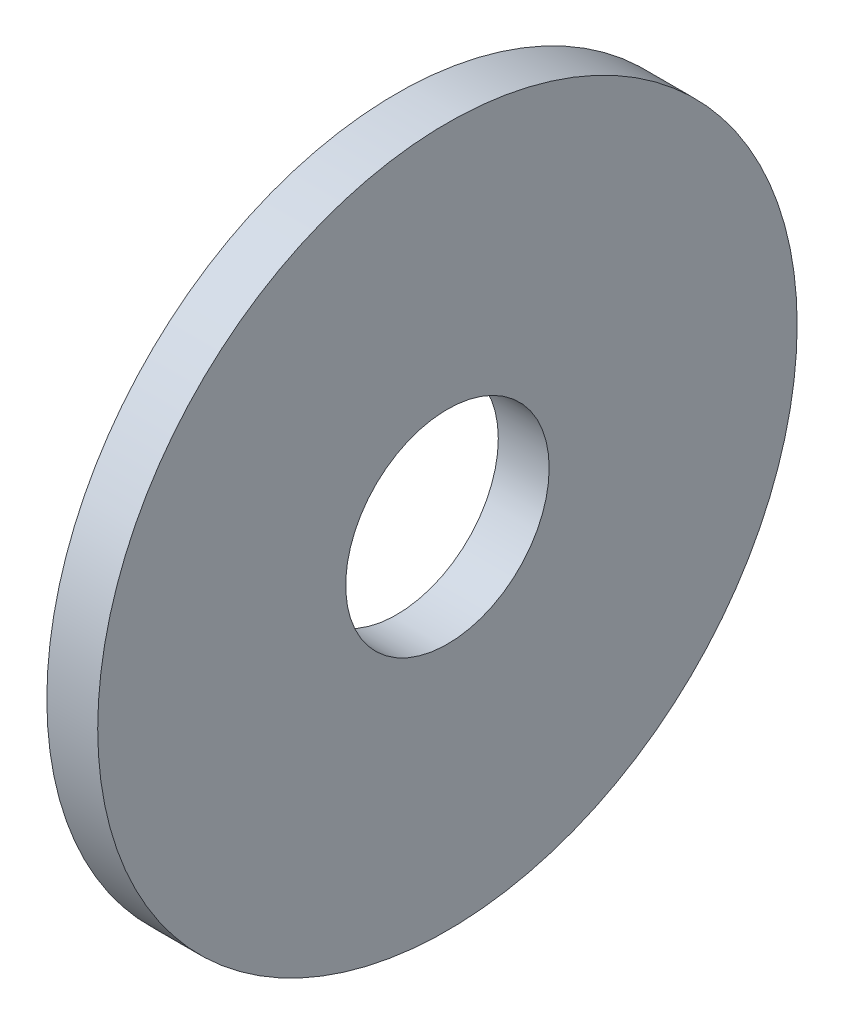
from build123d import *

# Parameters (mm, degrees)
SKETCH1_R          = 5.5
SKETCH1_R_2        = 1.6
BASE_EXTRUDE_DEPTH = 0.8


with BuildPart() as part:
    # Sketch1 → Base-Extrude (new body)
    with BuildSketch(Plane(origin=(0, 0, 0), x_dir=(0, 0, -1), z_dir=(1, 0, 0))):
        Circle(SKETCH1_R)
        Circle(SKETCH1_R_2, mode=Mode.SUBTRACT)
    extrude(amount=BASE_EXTRUDE_DEPTH)


solid = part.part
